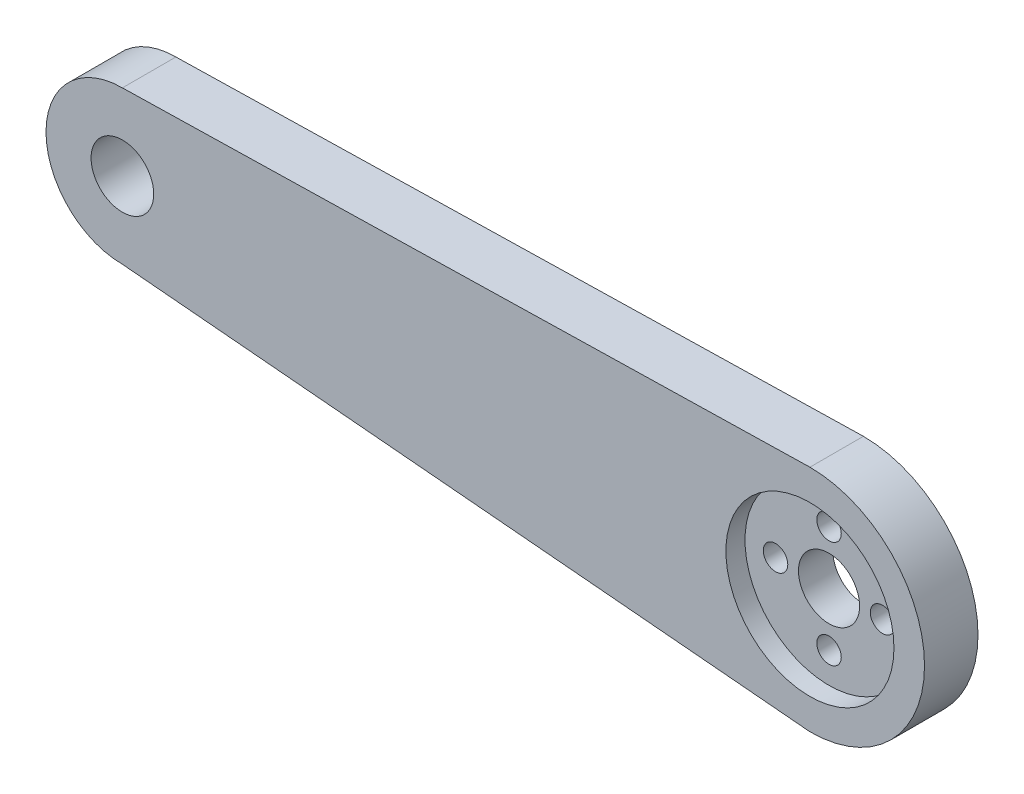
from build123d import *

# Parameters (mm, degrees)
EXTRUDE_1_DEPTH     = 7
SKETCH_2_R          = 4.1
SKETCH_2_R_2        = 1.6
SKETCH_2_R_3        = 4
CUT_EXTRUDE_1_DEPTH = 10
SKETCH_3_R          = 11
CUT_EXTRUDE_2_DEPTH = 2.5


with BuildPart() as part:
    # 草图1 → 凸台-拉伸1 (new body)
    with BuildSketch(Plane.XY):
        with BuildLine():
            Line((0, -10), (90, -18))
            ThreePointArc((90, -18), (105, -3), (90, 12))
            Line((90, 12), (0, 10))
            ThreePointArc((0, 10), (-10, 0), (0, -10))
        make_face()
    extrude(amount=EXTRUDE_1_DEPTH)

    # 草图2 → 切除-拉伸1 (cut)
    with BuildSketch(Plane(origin=(0, 0, 0), x_dir=(-1, 0, 0), z_dir=(0, 0, -1))):
        Circle(SKETCH_2_R)
        with Locations((-90, -10)):
            Circle(SKETCH_2_R_2)
        with Locations((-83, -3)):
            Circle(SKETCH_2_R_2)
        with Locations((-90, 4)):
            Circle(SKETCH_2_R_2)
        with Locations((-97, -3)):
            Circle(SKETCH_2_R_2)
        with Locations((-90, -3)):
            Circle(SKETCH_2_R_3)
    extrude(amount=-CUT_EXTRUDE_1_DEPTH, mode=Mode.SUBTRACT)

    # 草图3 → 切除-拉伸2 (cut)
    with BuildSketch(Plane.XY.offset(7)):
        with Locations((90, -3)):
            Circle(SKETCH_3_R)
    extrude(amount=-CUT_EXTRUDE_2_DEPTH, mode=Mode.SUBTRACT)


solid = part.part
